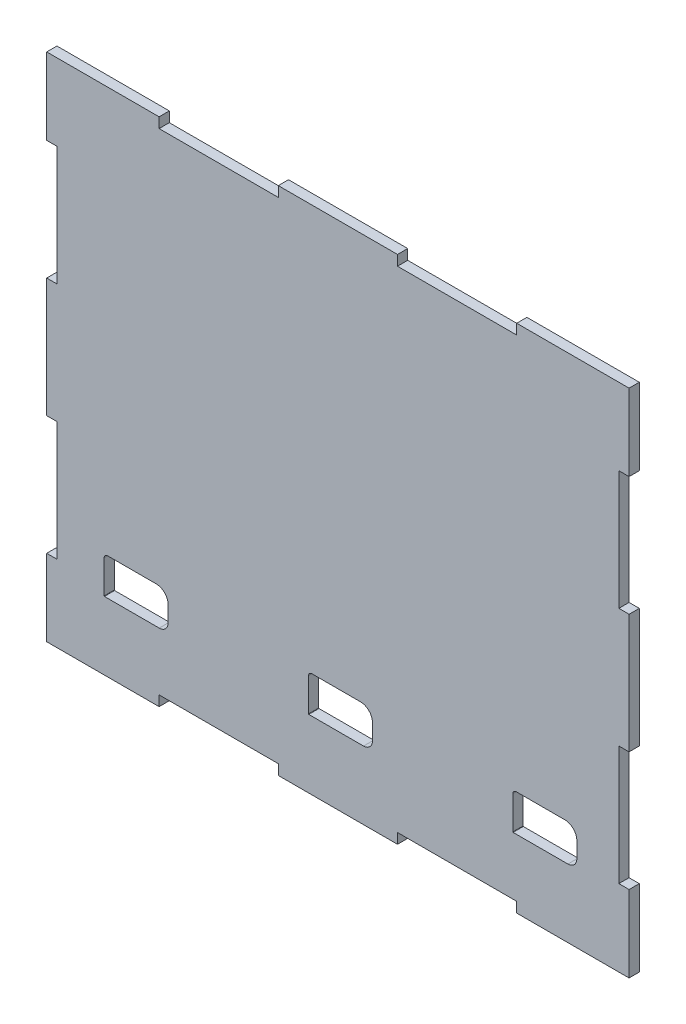
from build123d import *

# Parameters (mm, degrees)
BOSS_EXTRUDE1_DEPTH = 3
CUT_EXTRUDE1_DEPTH  = 114.772799913


with BuildPart() as part:
    # Model → Boss-Extrude1 (new body)
    with BuildSketch(Plane.XY):
        Polygon((85.5, 75), (82.5, 75), (52.5, 75), (52.5, 72), (17.5, 72), (17.5, 75), (-17.5, 75), (-17.5, 72), (-52.5, 72), (-52.5, 75), (-82.5, 75), (-85.5, 75), (-85.5, 72), (-85.5, 52.5), (-82.5, 52.5), (-82.5, 17.5), (-85.5, 17.5), (-85.5, -17.5), (-82.5, -17.5), (-82.5, -52.5), (-85.5, -52.5), (-85.5, -72), (-85.5, -75), (-82.5, -75), (-52.5, -75), (-52.5, -72), (-17.5, -72), (-17.5, -75), (17.5, -75), (17.5, -72), (52.5, -72), (52.5, -75), (82.5, -75), (85.5, -75), (85.5, -72), (85.5, -52.5), (82.5, -52.5), (82.5, -17.5), (85.5, -17.5), (85.5, 17.5), (82.5, 17.5), (82.5, 52.5), (85.5, 52.5), (85.5, 72), align=None)
    extrude(amount=BOSS_EXTRUDE1_DEPTH)

    # Sketch2 → Cut-Extrude1 (cut, through all)
    with BuildSketch(Plane.XY.offset(3)):
        with BuildLine():
            Line((-52.4625, -55), (-68.5375, -55))
            ThreePointArc((-68.5375, -55), (-68.608210678, -54.970710678), (-68.6375, -54.9))
            Line((-68.6375, -54.9), (-68.6375, -45.2))
            ThreePointArc((-68.6375, -45.2), (-68.344606781, -44.492893219), (-67.6375, -44.2))
            Line((-67.6375, -44.2), (-53.3625, -44.2))
            ThreePointArc((-53.3625, -44.2), (-50.869948596, -45.232448596), (-49.8375, -47.725))
            Line((-49.8375, -47.725), (-49.8375, -52.375))
            ThreePointArc((-49.8375, -52.375), (-50.606344699, -54.231155301), (-52.4625, -55))
        make_face()
        with BuildLine():
            Line((7.5375, -55), (-8.5375, -55))
            ThreePointArc((-8.5375, -55), (-8.608210678, -54.970710678), (-8.6375, -54.9))
            Line((-8.6375, -54.9), (-8.6375, -45.2))
            ThreePointArc((-8.6375, -45.2), (-8.344606781, -44.492893219), (-7.6375, -44.2))
            Line((-7.6375, -44.2), (6.6375, -44.2))
            ThreePointArc((6.6375, -44.2), (9.130051404, -45.232448596), (10.1625, -47.725))
            Line((10.1625, -47.725), (10.1625, -52.375))
            ThreePointArc((10.1625, -52.375), (9.393655301, -54.231155301), (7.5375, -55))
        make_face()
        with BuildLine():
            Line((67.5375, -55), (51.4625, -55))
            ThreePointArc((51.4625, -55), (51.391789322, -54.970710678), (51.3625, -54.9))
            Line((51.3625, -54.9), (51.3625, -45.2))
            ThreePointArc((51.3625, -45.2), (51.655393219, -44.492893219), (52.3625, -44.2))
            Line((52.3625, -44.2), (66.6375, -44.2))
            ThreePointArc((66.6375, -44.2), (69.130051404, -45.232448596), (70.1625, -47.725))
            Line((70.1625, -47.725), (70.1625, -52.375))
            ThreePointArc((70.1625, -52.375), (69.393655301, -54.231155301), (67.5375, -55))
        make_face()
    extrude(amount=-CUT_EXTRUDE1_DEPTH, mode=Mode.SUBTRACT)


solid = part.part
